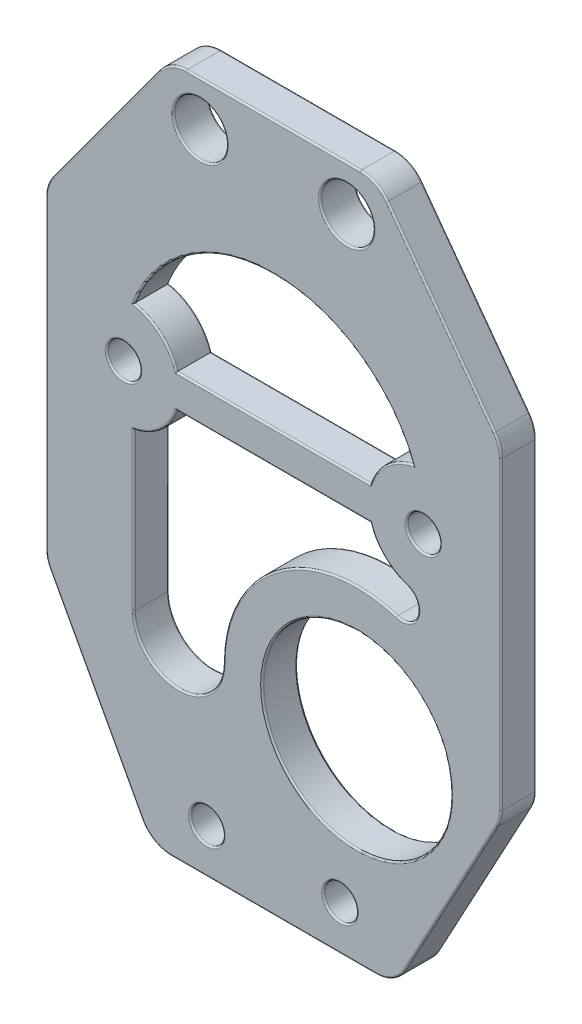
from build123d import *

# Parameters (mm, degrees)
SKETCH2_R           = 1.5
SKETCH2_R_2         = 2.395
SKETCH2_R_3         = 8.5
BOSS_EXTRUDE1_DEPTH = 3.175
FILLET1_R           = 3
FILLET2_R           = 0.15


with BuildPart() as part:
    # Sketch2 → Boss-Extrude1 (new body)
    with BuildSketch(Plane.XY):
        Polygon((-20.5, 17.599715907), (-11, 0), (11, 0), (20.5, 17.599715907), (20.5, 46.795191893), (9.358352436, 62), (-9.358352436, 62), (-20.5, 46.795191893), align=None)
        with BuildLine():
            ThreePointArc((12, 31.725495886), (12.980908802, 29.844587084), (11.1, 28.863678282))
            ThreePointArc((11.1, 28.863678282), (0.40070426, 27.091117163), (-4.5, 17.416407865))
            ThreePointArc((-4.5, 17.416407865), (-8.537037037, 13.379370828), (-12.574074074, 17.416407865))
            Line((-12.574074074, 17.416407865), (-12.574074074, 31.581673685))
            ThreePointArc((-12.574074074, 31.581673685), (-10.179901517, 32.756616488), (-8.730303993, 34.995191893))
            Line((-8.730303993, 34.995191893), (8.730303993, 34.995191893))
            ThreePointArc((8.730303993, 34.995191893), (9.964466094, 32.959657987), (12, 31.725495886))
        make_face(mode=Mode.SUBTRACT)
        with BuildLine():
            ThreePointArc((-12.574074074, 41.408710101), (0, 49.995191893), (12.574074074, 41.408710101))
            ThreePointArc((12.574074074, 41.408710101), (10.179901517, 40.233767298), (8.730303993, 37.995191893))
            Line((8.730303993, 37.995191893), (-8.730303993, 37.995191893))
            ThreePointArc((-8.730303993, 37.995191893), (-10.179901517, 40.233767298), (-12.574074074, 41.408710101))
        make_face(mode=Mode.SUBTRACT)
        with Locations((-6, 4)):
            Circle(SKETCH2_R, mode=Mode.SUBTRACT)
        with Locations((6, 4)):
            Circle(SKETCH2_R, mode=Mode.SUBTRACT)
        with Locations((-6.608352436, 58)):
            Circle(SKETCH2_R_2, mode=Mode.SUBTRACT)
        with Locations((6.608352436, 58)):
            Circle(SKETCH2_R_2, mode=Mode.SUBTRACT)
        with Locations((7.5, 17.416407865)):
            Circle(SKETCH2_R_3, mode=Mode.SUBTRACT)
        with Locations((13.5, 36.495191893)):
            Circle(SKETCH2_R, mode=Mode.SUBTRACT)
        with Locations((-13.5, 36.495191893)):
            Circle(SKETCH2_R, mode=Mode.SUBTRACT)
    extrude(amount=BOSS_EXTRUDE1_DEPTH)

    # Fillet1
    fillet1_edges = [part.edges().sort_by_distance(p)[0] for p in [
        (-11, 0, 1.5875),
        (-20.5, 17.599715907, 1.5875),
        (-20.5, 46.795191893, 1.5875),
        (-9.358352436, 62, 1.5875),
        (9.358352436, 62, 1.5875),
        (20.5, 46.795191893, 1.5875),
        (20.5, 17.599715907, 1.5875),
        (11, 0, 1.5875),
    ]]
    fillet(fillet1_edges, radius=FILLET1_R)

    # Fillet2
    fillet2_edges = [part.edges().sort_by_distance(p)[0] for p in [
        (-15.995056577, 9.253850179, 0),
        (-15.995056577, 9.253850179, 3.175),
        (-20.408596926, 17.622809943, 0),
        (-10.747240997, 0.423665394, 0),
        (-20.5, 32.085693944, 0),
        (0, 0, 0),
        (-20.351279544, 46.746535301, 0),
        (10.747240997, 0.423665394, 0),
        (-15.088587451, 54.180050275, 0),
        (15.995056577, 9.253850179, 0),
        (-9.193984301, 61.675782084, 0),
        (20.408596926, 17.622809943, 0),
        (0, 62, 0),
        (20.5, 32.085693944, 0),
        (9.193984301, 61.675782084, 0),
        (20.351279544, 46.746535301, 0),
        (15.088587451, 54.180050275, 0),
        (0.40070426, 27.091117163, 0),
        (-8.537037037, 13.379370828, 0),
        (-12.574074074, 24.499040775, 0),
        (-10.179901517, 32.756616488, 0),
        (0, 34.995191893, 0),
        (9.964466094, 32.959657987, 0),
        (12.980908802, 29.844587084, 0),
        (0, 49.995191893, 0),
        (10.179901517, 40.233767298, 0),
        (0, 37.995191893, 0),
        (-10.179901517, 40.233767298, 0),
        (-7.5, 4, 0),
        (4.5, 4, 0),
        (-9.003352436, 58, 0),
        (4.213352436, 58, 0),
        (-1, 17.416407865, 0),
        (12, 36.495191893, 0),
        (-15, 36.495191893, 0),
        (-20.408596926, 17.622809943, 3.175),
        (-10.747240997, 0.423665394, 3.175),
        (-20.5, 32.085693944, 3.175),
        (0, 0, 3.175),
        (-20.351279544, 46.746535301, 3.175),
        (10.747240997, 0.423665394, 3.175),
        (-15.088587451, 54.180050275, 3.175),
        (15.995056577, 9.253850179, 3.175),
        (-9.193984301, 61.675782084, 3.175),
        (20.408596926, 17.622809943, 3.175),
        (0, 62, 3.175),
        (20.5, 32.085693944, 3.175),
        (9.193984301, 61.675782084, 3.175),
        (20.351279544, 46.746535301, 3.175),
        (15.088587451, 54.180050275, 3.175),
        (0.40070426, 27.091117163, 3.175),
        (-8.537037037, 13.379370828, 3.175),
        (-12.574074074, 24.499040775, 3.175),
        (-10.179901517, 32.756616488, 3.175),
        (0, 34.995191893, 3.175),
        (9.964466094, 32.959657987, 3.175),
        (12.980908802, 29.844587084, 3.175),
        (0, 49.995191893, 3.175),
        (10.179901517, 40.233767298, 3.175),
        (0, 37.995191893, 3.175),
        (-10.179901517, 40.233767298, 3.175),
        (-7.5, 4, 3.175),
        (4.5, 4, 3.175),
        (-9.003352436, 58, 3.175),
        (4.213352436, 58, 3.175),
        (-1, 17.416407865, 3.175),
        (12, 36.495191893, 3.175),
        (-15, 36.495191893, 3.175),
    ]]
    fillet(fillet2_edges, radius=FILLET2_R)


solid = part.part
